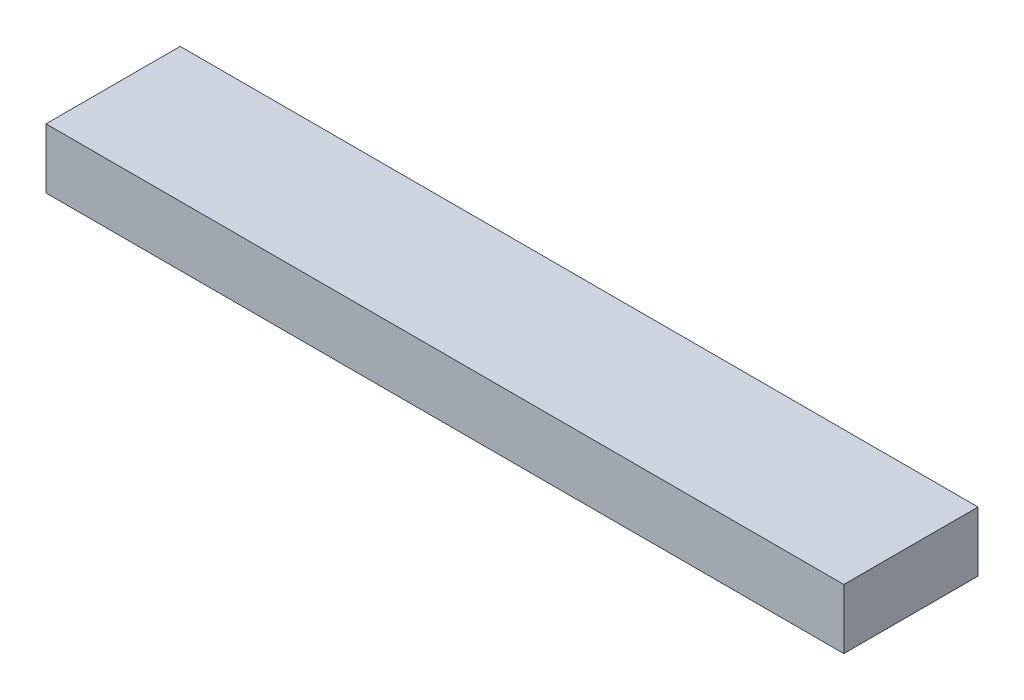
from build123d import *

# Parameters (mm, degrees)
SKETCH1_W           = 66.6
SKETCH1_H           = 5
BOSS_EXTRUDE1_DEPTH = 11.2


with BuildPart() as part:
    # Sketch1 → Boss-Extrude1 (new body)
    with BuildSketch(Plane.XY):
        Rectangle(SKETCH1_W, SKETCH1_H)
    extrude(amount=BOSS_EXTRUDE1_DEPTH)


solid = part.part
